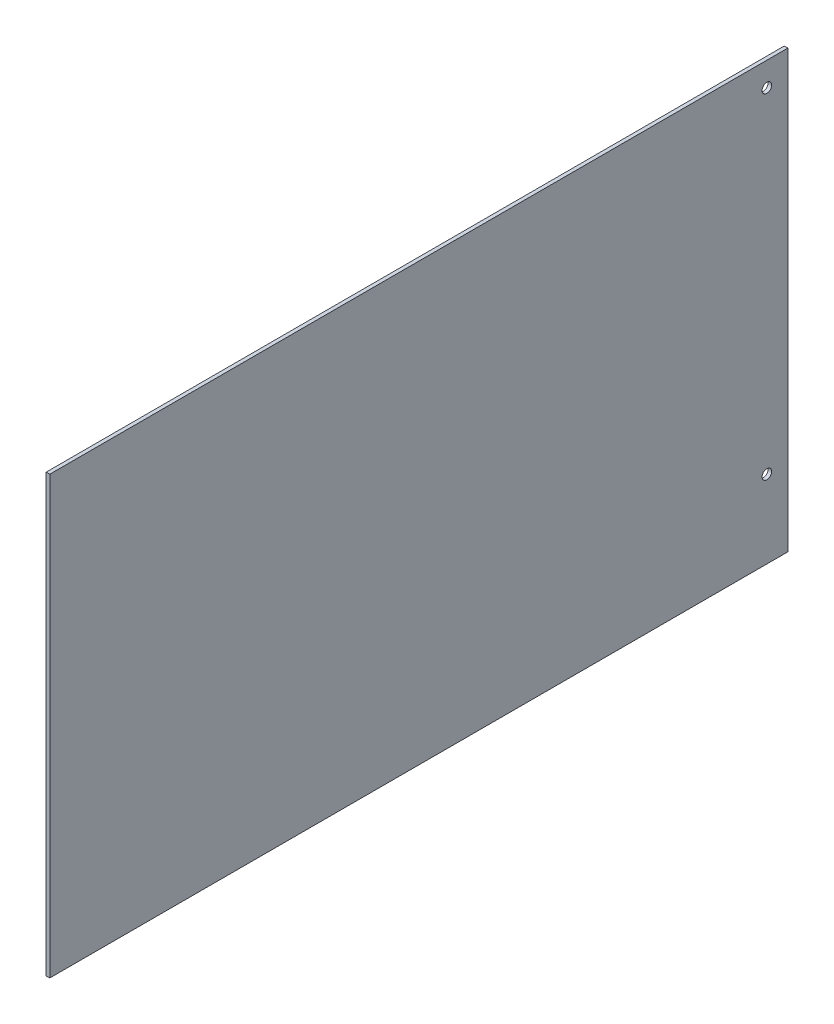
from build123d import *

# Parameters (mm, degrees)
SKETCH1_W           = 617.1
SKETCH1_H           = 364.8
BOSS_EXTRUDE1_DEPTH = 3
SKETCH2_R           = 4
CUT_EXTRUDE1_DEPTH  = 445.587795398


with BuildPart() as part:
    # Sketch1 → Boss-Extrude1 (new body)
    with BuildSketch(Plane(origin=(0, 0, 0), x_dir=(0, 0, -1), z_dir=(1, 0, 0))):
        with Locations((-84.043773624, -26.213126933)):
            Rectangle(SKETCH1_W, SKETCH1_H)
    extrude(amount=BOSS_EXTRUDE1_DEPTH)

    # Sketch2 → Cut-Extrude1 (cut, through all)
    with BuildSketch(Plane.ZY):
        with Locations((-207.006226376, -143.613126933)):
            Circle(SKETCH2_R)
        with Locations((-207.006226376, 136.186873067)):
            Circle(SKETCH2_R)
    extrude(amount=-CUT_EXTRUDE1_DEPTH, mode=Mode.SUBTRACT)


solid = part.part
